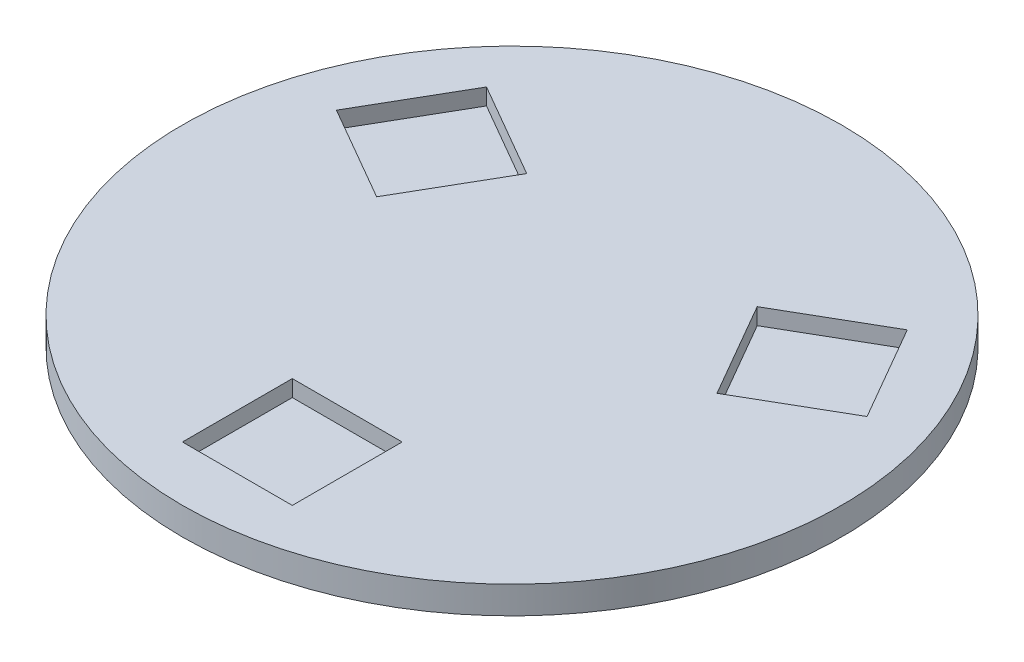
from build123d import *

# Parameters (mm, degrees)
SKETCH1_R           = 3000
BOSS_EXTRUDE1_DEPTH = 250
SKETCH2_W           = 1000
SKETCH2_H           = 1000
CUT_EXTRUDE1_DEPTH  = 150
CIRPATTERN1_COUNT   = 3


with BuildPart() as part:
    # Sketch1 → Boss-Extrude1 (new body)
    with BuildSketch(Plane(origin=(0, 0, 0), x_dir=(1, 0, 0), z_dir=(0, 1, 0))):
        with Locations(Location((0, 0, 0), (0, 0, 270))):
            Circle(SKETCH1_R)
    extrude(amount=BOSS_EXTRUDE1_DEPTH)

    # Sketch2 → Cut-Extrude1 (cut)
    with BuildSketch(Plane(origin=(0, 250, 0), x_dir=(1, 0, 0), z_dir=(0, 1, 0))):
        with Locations((0, -2000)):
            Rectangle(SKETCH2_W, SKETCH2_H)
    cut_extrude1 = extrude(amount=-CUT_EXTRUDE1_DEPTH, mode=Mode.SUBTRACT)

    # CirPattern1: Cut-Extrude1 ×3 about axis
    cirpattern1_axis = Axis((0, 0, 0), (0, 1, 0))
    for i in range(1, CIRPATTERN1_COUNT):
        add(cut_extrude1.rotate(cirpattern1_axis, i * 360 / CIRPATTERN1_COUNT), mode=Mode.SUBTRACT)


solid = part.part
